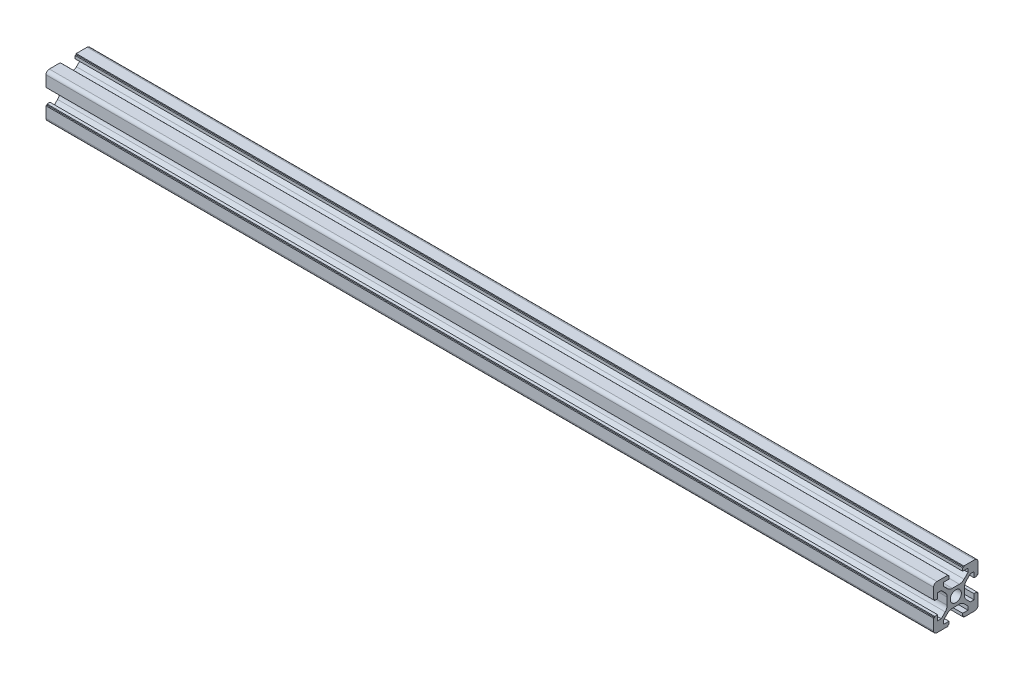
from build123d import *

# Parameters (mm, degrees)
EXTRUDE_1_DEPTH = 400
FILLET_1_R      = 1.5
FILLET_2_R      = 3


with BuildPart() as part:
    # 草图1 → 凸台-拉伸1 (new body)
    with BuildSketch(Plane(origin=(0, 0, 0), x_dir=(0, 0, -1), z_dir=(1, 0, 0))):
        Polygon((-10, 10), (-10, 3.6), (-9.530955747, 3.6), (-9.530955747, 3.1), (-8.2, 3.1), (-8.2, 5.5), (-6.560660172, 5.5), (-3.9, 2.839339828), (-3.9, 0), (-3.9, -2.839339828), (-6.560660172, -5.5), (-8.2, -5.5), (-8.2, -3.1), (-9.530955747, -3.1), (-9.530955747, -3.6), (-10, -3.6), (-10, -10), (-3.6, -10), (-3.6, -9.530955747), (-3.1, -9.530955747), (-3.1, -8.2), (-5.5, -8.2), (-5.5, -6.560660172), (-2.839339828, -3.9), (0, -3.9), (2.839339828, -3.9), (5.5, -6.560660172), (5.5, -8.2), (3.1, -8.2), (3.1, -9.530955747), (3.6, -9.530955747), (3.6, -10), (10, -10), (10, -3.6), (9.530955747, -3.6), (9.530955747, -3.1), (8.2, -3.1), (8.2, -5.5), (6.560660172, -5.5), (3.9, -2.839339828), (3.9, 0), (3.9, 2.839339828), (6.560660172, 5.5), (8.2, 5.5), (8.2, 3.1), (9.530955747, 3.1), (9.530955747, 3.6), (10, 3.6), (10, 10), (3.6, 10), (3.6, 9.530955747), (3.1, 9.530955747), (3.1, 8.2), (5.5, 8.2), (5.5, 6.560660172), (2.839339828, 3.9), (0, 3.9), (-2.839339828, 3.9), (-5.5, 6.560660172), (-5.5, 8.2), (-3.1, 8.2), (-3.1, 9.530955747), (-3.6, 9.530955747), (-3.6, 10), align=None)
        with BuildLine():
            ThreePointArc((0, 2.5), (-1.767766953, 1.767766953), (-2.5, 0))
            ThreePointArc((-2.5, 0), (-1.767766953, -1.767766953), (0, -2.5))
            ThreePointArc((0, -2.5), (1.767766953, -1.767766953), (2.5, 0))
            ThreePointArc((2.5, 0), (1.767766953, 1.767766953), (0, 2.5))
        make_face(mode=Mode.SUBTRACT)
    extrude(amount=EXTRUDE_1_DEPTH)

    # 圆角1
    fillet_1_edges = [part.edges().sort_by_distance(p)[0] for p in [
        (200, -10, -10),
        (200, -10, 10),
        (200, 10, 10),
        (200, 10, -10),
    ]]
    fillet(fillet_1_edges, radius=FILLET_1_R)

    # 圆角2
    fillet_2_edges = [part.edges().sort_by_distance(p)[0] for p in [
        (200, -3.9, -2.839339828),
        (200, -3.9, 2.839339828),
        (200, -2.839339828, 3.9),
        (200, 2.839339828, 3.9),
        (200, 3.9, 2.839339828),
        (200, 3.9, -2.839339828),
        (200, 2.839339828, -3.9),
        (200, -2.839339828, -3.9),
    ]]
    fillet(fillet_2_edges, radius=FILLET_2_R)


solid = part.part
